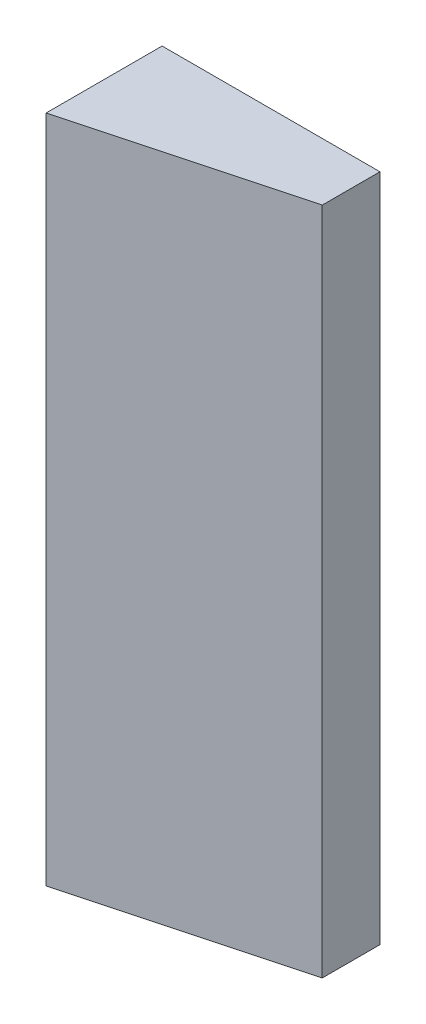
from build123d import *

# Parameters (mm, degrees)
SKETCH1_W                       = 15.1
SKETCH1_H                       = 46.4
SKETCH1_W_2                     = 9.1
SKETCH1_H_2                     = 40.4
BOSS_EXTRUDE1_DEPTH             = 4
TAP_DRILL_FOR_M2X0_4_TAP1_D     = 1.8
TAP_DRILL_FOR_M2X0_4_TAP1_DEPTH = 10
TAP_DRILL_FOR_M2X0_4_TAP1_TIP   = 0.540774557
BOSS_EXTRUDE2_DEPTH             = 46.4


with BuildPart() as part:
    # Sketch1 → Boss-Extrude1 (new body)
    # profile 1 of 2: a face of its own
    with BuildSketch(Plane.XY):
        Rectangle(SKETCH1_W, SKETCH1_H)
        Rectangle(SKETCH1_W_2, SKETCH1_H_2, mode=Mode.SUBTRACT)
    # profile 2 of 2: a face of its own
    with BuildSketch(Plane.XY):
        Rectangle(SKETCH1_W_2, SKETCH1_H_2)
    extrude(amount=BOSS_EXTRUDE1_DEPTH)

    # Tap Drill for M2x0.4 Tap1
    with Locations(Plane(origin=(-4.55, 20.2, 4), x_dir=(1, 0, 0), z_dir=(0, 0, 1))):
        with Locations((0, 0), (9.1, 0), (9.1, -40.4), (0, -40.4)):
            Hole(TAP_DRILL_FOR_M2X0_4_TAP1_D / 2, depth=TAP_DRILL_FOR_M2X0_4_TAP1_DEPTH)
            with Locations((0, 0, -(TAP_DRILL_FOR_M2X0_4_TAP1_DEPTH + TAP_DRILL_FOR_M2X0_4_TAP1_TIP / 2))):  # 118° drill point
                Cone(0, TAP_DRILL_FOR_M2X0_4_TAP1_D / 2, TAP_DRILL_FOR_M2X0_4_TAP1_TIP, mode=Mode.SUBTRACT)

    # Sketch5 → Boss-Extrude2 (add)
    with BuildSketch(Plane(origin=(0, -23.2, 0), x_dir=(-1, 0, 0), z_dir=(0, -1, 0))):
        Polygon((-7.55, -4), (7.55, -8.046032806), (7.55, -4), align=None)
    extrude(amount=-BOSS_EXTRUDE2_DEPTH)


solid = part.part
